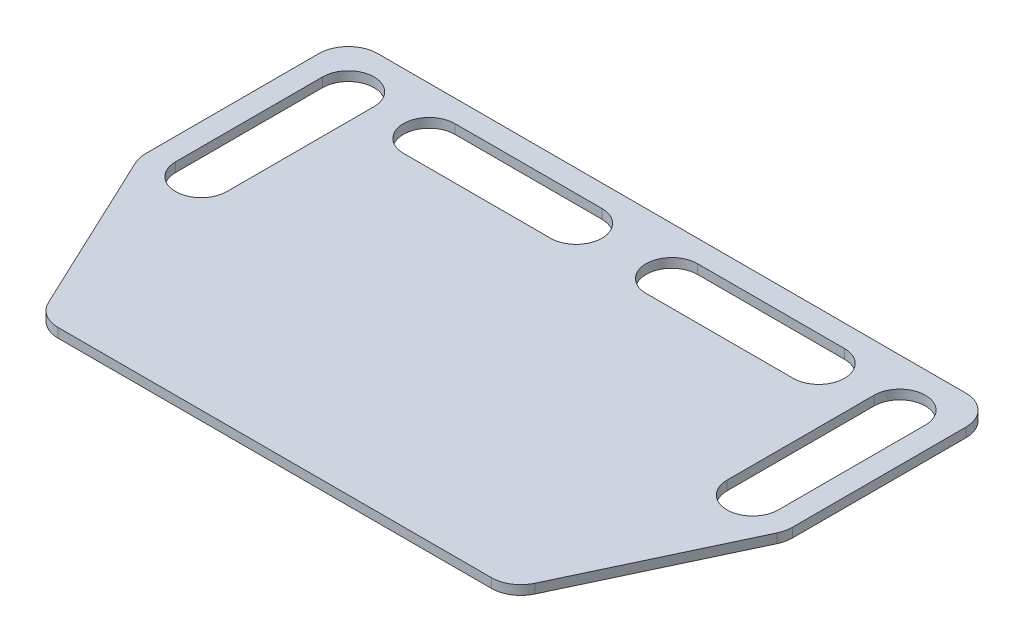
from build123d import *

# Parameters (mm, degrees)
BOSS_EXTRUDE1_DEPTH = 6.35


with BuildPart() as part:
    # Sketch1 → Boss-Extrude1 (new body)
    with BuildSketch(Plane(origin=(0, 0, 0), x_dir=(1, 0, 0), z_dir=(0, 1, 0))):
        with BuildLine():
            Line((-147.307889143, -110), (147.307889143, -110))
            ThreePointArc((147.307889143, -110), (158.024259459, -106.886663592), (165.404263187, -98.515940727))
            Line((165.404263187, -98.515940727), (218.096374044, 13.454794844))
            ThreePointArc((218.096374044, 13.454794844), (219.518292457, 17.607679352), (220, 21.97073557))
            Line((220, 21.97073557), (220, 140))
            ThreePointArc((220, 140), (214.142135624, 154.142135624), (200, 160))
            Line((200, 160), (-200, 160))
            ThreePointArc((-200, 160), (-214.142135624, 154.142135624), (-220, 140))
            Line((-220, 140), (-220, 21.97073557))
            ThreePointArc((-220, 21.97073557), (-219.518292457, 17.607679352), (-218.096374044, 13.454794844))
            Line((-218.096374044, 13.454794844), (-165.404263187, -98.515940727))
            ThreePointArc((-165.404263187, -98.515940727), (-158.024259459, -106.886663592), (-147.307889143, -110))
        make_face()
        with BuildLine():
            Line((-170, 127.5), (-170, 27.5))
            ThreePointArc((-170, 27.5), (-187.5, 10), (-205, 27.5))
            Line((-205, 27.5), (-205, 127.5))
            ThreePointArc((-205, 127.5), (-187.5, 145), (-170, 127.5))
        make_face(mode=Mode.SUBTRACT)
        with BuildLine():
            Line((-132.5, 145), (-32.5, 145))
            ThreePointArc((-32.5, 145), (-15, 127.5), (-32.5, 110))
            Line((-32.5, 110), (-132.5, 110))
            ThreePointArc((-132.5, 110), (-150, 127.5), (-132.5, 145))
        make_face(mode=Mode.SUBTRACT)
        with BuildLine():
            Line((205, 127.5), (205, 27.5))
            ThreePointArc((205, 27.5), (187.5, 10), (170, 27.5))
            Line((170, 27.5), (170, 127.5))
            ThreePointArc((170, 127.5), (187.5, 145), (205, 127.5))
        make_face(mode=Mode.SUBTRACT)
        with BuildLine():
            Line((32.5, 145), (132.5, 145))
            ThreePointArc((132.5, 145), (150, 127.5), (132.5, 110))
            Line((132.5, 110), (32.5, 110))
            ThreePointArc((32.5, 110), (15, 127.5), (32.5, 145))
        make_face(mode=Mode.SUBTRACT)
    extrude(amount=BOSS_EXTRUDE1_DEPTH)


solid = part.part
